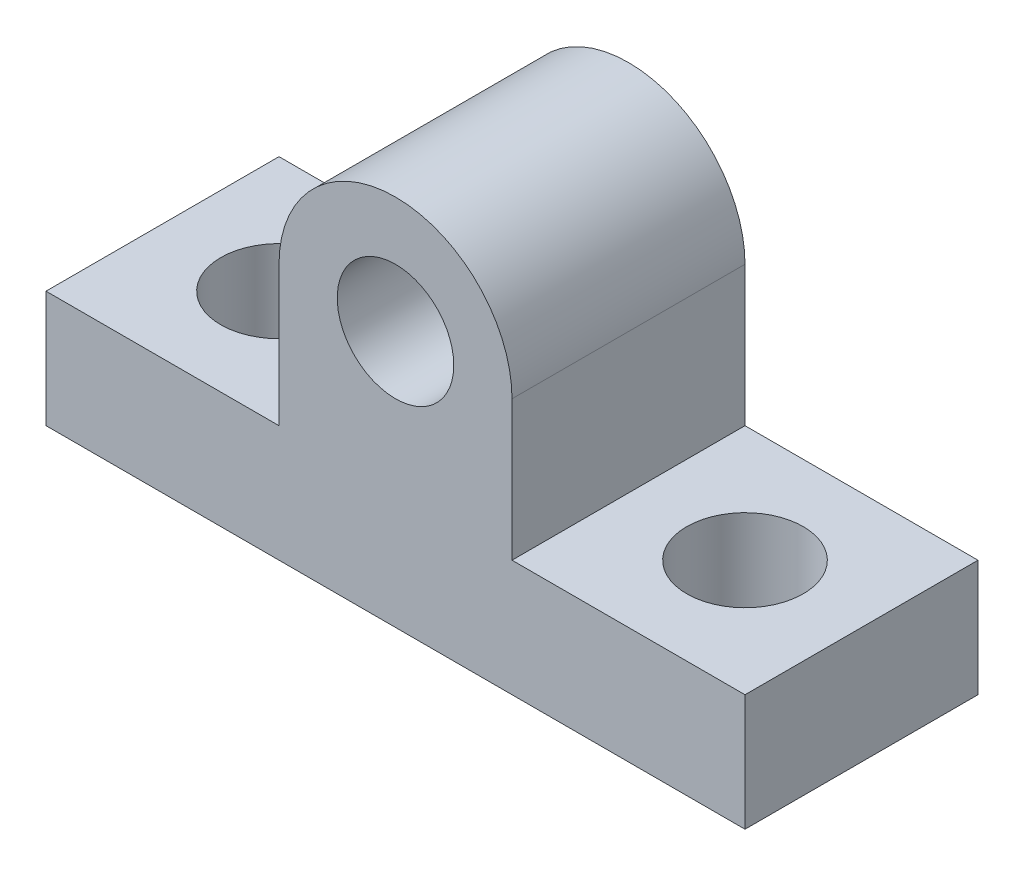
from build123d import *

# Parameters (mm, degrees)
SKETCH_1_R          = 2.5
EXTRUDE_1_DEPTH     = 10
SKETCH_2_R          = 2.5
CUT_EXTRUDE_1_DEPTH = 5
SKETCH_3_R          = 2.5
CUT_EXTRUDE_2_DEPTH = 5


with BuildPart() as part:
    # 草图1 → 凸台-拉伸1 (new body)
    with BuildSketch(Plane.XY):
        with BuildLine():
            Line((5, 0), (15, 0))
            Line((15, 0), (15, -5))
            Line((15, -5), (-15, -5))
            Line((-15, -5), (-15, 0))
            Line((-15, 0), (-5, 0))
            Line((-5, 0), (-5, 6))
            ThreePointArc((-5, 6), (0, 11), (5, 6))
            Line((5, 6), (5, 0))
        make_face()
        with Locations((0, 6)):
            Circle(SKETCH_1_R, mode=Mode.SUBTRACT)
    extrude(amount=EXTRUDE_1_DEPTH)

    # 草图2 → 切除-拉伸1 (cut)
    with BuildSketch(Plane(origin=(0, 0, 0), x_dir=(1, 0, 0), z_dir=(0, 1, 0))):
        with Locations(Location((-10, -5, 0), (0, 0, 180))):
            Circle(SKETCH_2_R)
    extrude(amount=-CUT_EXTRUDE_1_DEPTH, mode=Mode.SUBTRACT)

    # 草图3 → 切除-拉伸2 (cut)
    with BuildSketch(Plane(origin=(0, 0, 0), x_dir=(1, 0, 0), z_dir=(0, 1, 0))):
        with Locations(Location((10, -5, 0), (0, 0, 180))):
            Circle(SKETCH_3_R)
    extrude(amount=-CUT_EXTRUDE_2_DEPTH, mode=Mode.SUBTRACT)


solid = part.part
